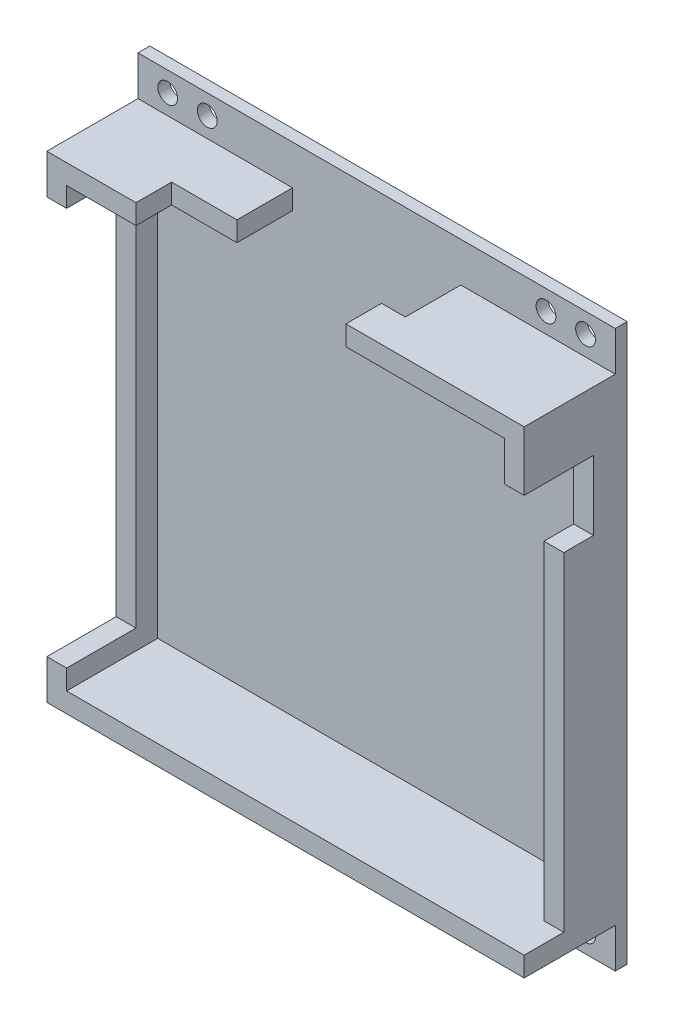
from build123d import *

# Parameters (mm, degrees)
SKETCH1_W           = 120.5
SKETCH1_H           = 120.5
SKETCH1_W_2         = 110.5
SKETCH1_H_2         = 110.5
BOSS_EXTRUDE1_DEPTH = 23
SKETCH2_W           = 120.5
SKETCH2_H           = 120.5
BOSS_EXTRUDE2_DEPTH = 3
SKETCH3_W           = 17.5
SKETCH3_H           = 100.5
CUT_EXTRUDE1_DEPTH  = 47
CUT_EXTRUDE2_DEPTH  = 47
CUT_EXTRUDE3_DEPTH  = 47
SKETCH7_W           = 120.5
SKETCH7_H           = 10
SKETCH7_R           = 2.5
BOSS_EXTRUDE3_DEPTH = 3


with BuildPart() as part:
    # Sketch1 → Boss-Extrude1 (new body)
    with BuildSketch(Plane.XY):
        Rectangle(SKETCH1_W, SKETCH1_H)
        Rectangle(SKETCH1_W_2, SKETCH1_H_2, mode=Mode.SUBTRACT)
    extrude(amount=BOSS_EXTRUDE1_DEPTH)

    # Sketch2 → Boss-Extrude2 (add)
    with BuildSketch(Plane(origin=(0, 0, 0), x_dir=(-1, 0, 0), z_dir=(0, 0, -1))):
        Rectangle(SKETCH2_W, SKETCH2_H)
    extrude(amount=BOSS_EXTRUDE2_DEPTH)

    # Sketch3 → Cut-Extrude1 (cut)
    with BuildSketch(Plane(origin=(-55.25, 0, 0), x_dir=(0, 0, -1), z_dir=(1, 0, 0))):
        with Locations((-14.25, 0)):
            Rectangle(SKETCH3_W, SKETCH3_H)
    extrude(amount=-CUT_EXTRUDE1_DEPTH, mode=Mode.SUBTRACT)

    # Sketch5 → Cut-Extrude2 (cut)
    with BuildSketch(Plane.XZ.offset(-55.25)):
        Polygon((-37.75, 23), (-37.75, 14), (-21.25, 14), (-21.25, 0), (21.25, 0), (21.25, 14), (15.25, 14), (15.25, 23), align=None)
    extrude(amount=-CUT_EXTRUDE2_DEPTH, mode=Mode.SUBTRACT)

    # Sketch6 → Cut-Extrude3 (cut)
    with BuildSketch(Plane.ZY.offset(-55.25)):
        Polygon((23, 45.25), (5.5, 45.25), (5.5, 27.75), (13, 27.75), (13, -55.25), (23, -55.25), align=None)
    extrude(amount=-CUT_EXTRUDE3_DEPTH, mode=Mode.SUBTRACT)

    # Sketch7 → Boss-Extrude3 (add)
    # profile 1 of 2: a face of its own
    with BuildSketch(Plane(origin=(0, 0, -3), x_dir=(-1, 0, 0), z_dir=(0, 0, -1))):
        with Locations((0, 65.25)):
            Rectangle(SKETCH7_W, SKETCH7_H)
        with Locations((-52.75, 65.25)):
            Circle(SKETCH7_R, mode=Mode.SUBTRACT)
        with Locations((-42.75, 65.25)):
            Circle(SKETCH7_R, mode=Mode.SUBTRACT)
        with Locations((52.75, 65.25)):
            Circle(SKETCH7_R, mode=Mode.SUBTRACT)
        with Locations((42.75, 65.25)):
            Circle(SKETCH7_R, mode=Mode.SUBTRACT)
    # profile 2 of 2: a face of its own
    with BuildSketch(Plane(origin=(0, 0, -3), x_dir=(-1, 0, 0), z_dir=(0, 0, -1))):
        with Locations((0, -65.25)):
            Rectangle(SKETCH7_W, SKETCH7_H)
        with Locations((-52.75, -65.25)):
            Circle(SKETCH7_R, mode=Mode.SUBTRACT)
        with Locations((-42.75, -65.25)):
            Circle(SKETCH7_R, mode=Mode.SUBTRACT)
        with Locations((42.75, -65.25)):
            Circle(SKETCH7_R, mode=Mode.SUBTRACT)
        with Locations((52.75, -65.25)):
            Circle(SKETCH7_R, mode=Mode.SUBTRACT)
    extrude(amount=-BOSS_EXTRUDE3_DEPTH)


solid = part.part
